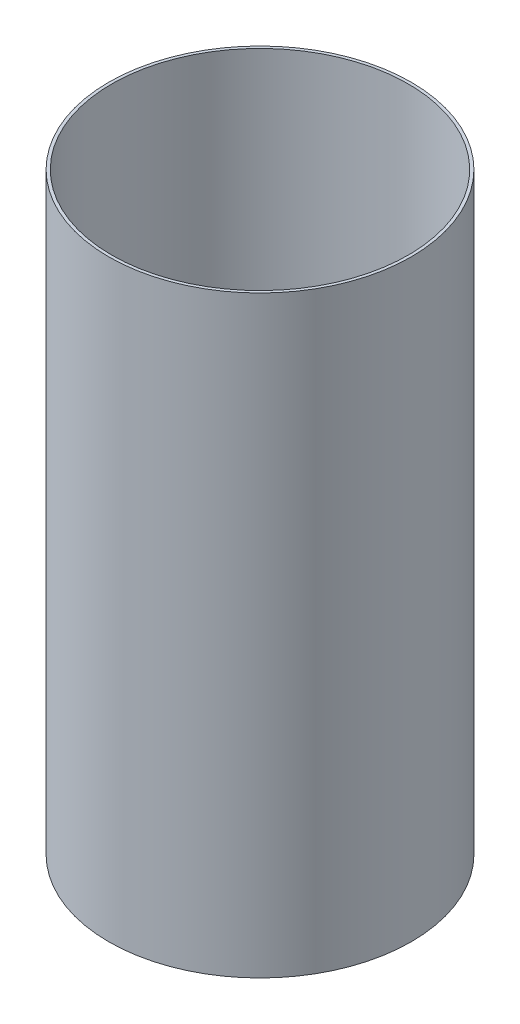
from build123d import *

# Parameters (mm, degrees)
SKETCH_1_R      = 51
SKETCH_1_R_2    = 50
EXTRUDE_1_DEPTH = 200


with BuildPart() as part:
    # Эскиз1 → Бобышка-Вытянуть1 (new body)
    with BuildSketch(Plane(origin=(0, 0, 0), x_dir=(1, 0, 0), z_dir=(0, 1, 0))):
        with Locations(Location((0, 0, 0), (0, 0, 270))):
            Circle(SKETCH_1_R)
        with Locations(Location((0, 0, 0), (0, 0, 270))):
            Circle(SKETCH_1_R_2, mode=Mode.SUBTRACT)
    extrude(amount=EXTRUDE_1_DEPTH)


solid = part.part
